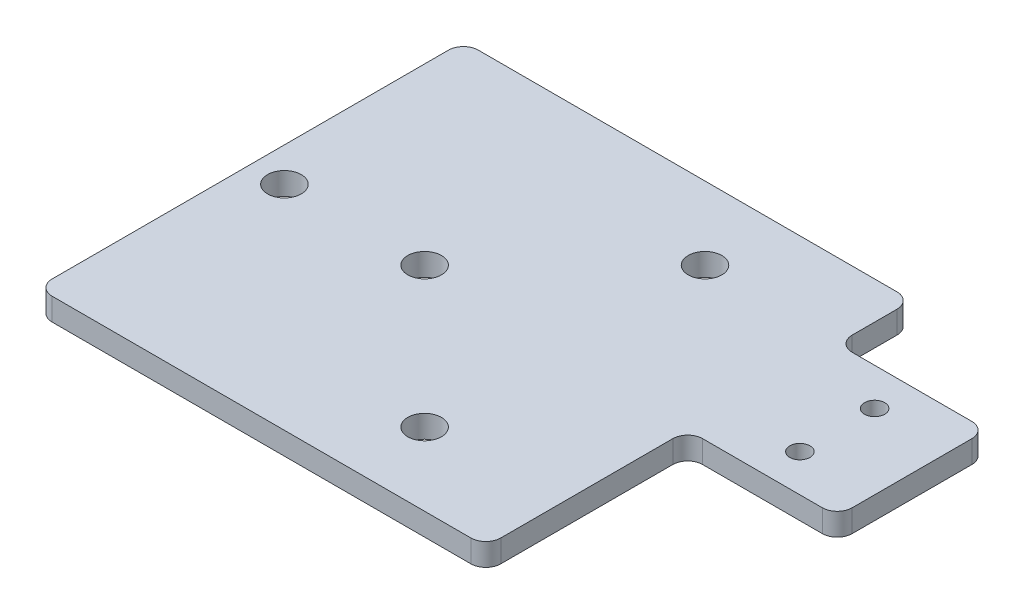
from build123d import *

# Parameters (mm, degrees)
SKETCH1_W                      = 60
SKETCH1_H                      = 57
BOSS_EXTRUDE1_DEPTH            = 3
F_4_5_4_5_DIAMETER_HOLE1_D     = 4.5
F_4_5_4_5_DIAMETER_HOLE1_DEPTH = 15
F_4_5_4_5_DIAMETER_HOLE1_TIP   = 1.351936393
SKETCH4_W                      = 20
SKETCH4_H                      = 20
BOSS_EXTRUDE2_DEPTH            = 3
F_2_7_2_7_DIAMETER_HOLE1_D     = 2.7
F_2_7_2_7_DIAMETER_HOLE1_DEPTH = 15
F_2_7_2_7_DIAMETER_HOLE1_TIP   = 0.811161836
FILLET1_R                      = 2


with BuildPart() as part:
    # Sketch1 → Boss-Extrude1 (new body)
    with BuildSketch(Plane(origin=(0, 0, 0), x_dir=(1, 0, 0), z_dir=(0, 1, 0))):
        Rectangle(SKETCH1_W, SKETCH1_H)
    extrude(amount=BOSS_EXTRUDE1_DEPTH)

    # Ø4.5 (4.5) Diameter Hole1
    with Locations(Plane(origin=(0, 3, 0), x_dir=(1, 0, 0), z_dir=(0, 1, 0))):
        with Locations((-25.437, 0), (-6.687, 0), (12.063, 18.75), (12.063, -18.75)):
            Hole(F_4_5_4_5_DIAMETER_HOLE1_D / 2, depth=F_4_5_4_5_DIAMETER_HOLE1_DEPTH)
            with Locations((0, 0, -(F_4_5_4_5_DIAMETER_HOLE1_DEPTH + F_4_5_4_5_DIAMETER_HOLE1_TIP / 2))):  # 118° drill point
                Cone(0, F_4_5_4_5_DIAMETER_HOLE1_D / 2, F_4_5_4_5_DIAMETER_HOLE1_TIP, mode=Mode.SUBTRACT)

    # Sketch4 → Boss-Extrude2 (add)
    with BuildSketch(Plane(origin=(0, 3, 0), x_dir=(1, 0, 0), z_dir=(0, 1, 0))):
        with Locations((40, 8.5)):
            Rectangle(SKETCH4_W, SKETCH4_H)
    extrude(amount=-BOSS_EXTRUDE2_DEPTH)

    # Ø2.7 (2.7) Diameter Hole1
    with Locations(Plane(origin=(0, 3, 0), x_dir=(1, 0, 0), z_dir=(0, 1, 0))):
        with Locations((40, 13.5), (40, 3.5)):
            Hole(F_2_7_2_7_DIAMETER_HOLE1_D / 2, depth=F_2_7_2_7_DIAMETER_HOLE1_DEPTH)
            with Locations((0, 0, -(F_2_7_2_7_DIAMETER_HOLE1_DEPTH + F_2_7_2_7_DIAMETER_HOLE1_TIP / 2))):  # 118° drill point
                Cone(0, F_2_7_2_7_DIAMETER_HOLE1_D / 2, F_2_7_2_7_DIAMETER_HOLE1_TIP, mode=Mode.SUBTRACT)

    # Fillet1
    fillet1_edges = [part.edges().sort_by_distance(p)[0] for p in [
        (30, 1.5, 1.5),
        (30, 1.5, -18.5),
        (50, 1.5, -18.5),
        (50, 1.5, 1.5),
        (30, 1.5, 28.5),
        (-30, 1.5, 28.5),
        (-30, 1.5, -28.5),
        (30, 1.5, -28.5),
    ]]
    fillet(fillet1_edges, radius=FILLET1_R)


solid = part.part
